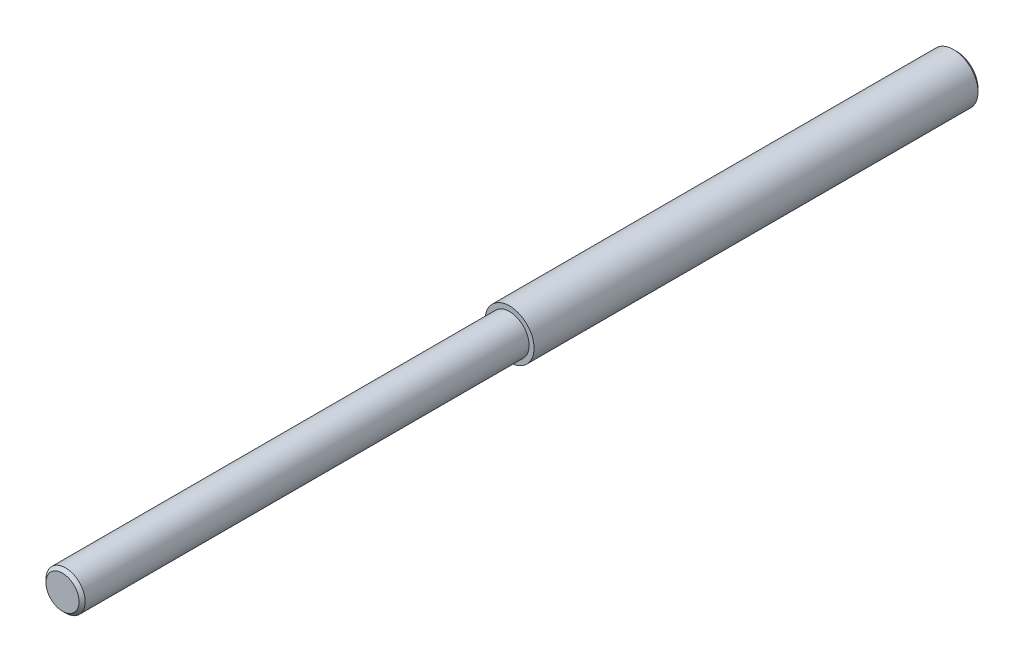
from build123d import *

# Parameters (mm, degrees)
SKETCH1_R           = 4
BOSS_EXTRUDE1_DEPTH = 73
SKETCH2_R           = 3.2
BOSS_EXTRUDE2_DEPTH = 73
CHAMFER1_SIZE       = 0.5


with BuildPart() as part:
    # Sketch1 → Boss-Extrude1 (new body)
    with BuildSketch(Plane.XY):
        Circle(SKETCH1_R)
    extrude(amount=BOSS_EXTRUDE1_DEPTH)

    # Sketch2 → Boss-Extrude2 (add)
    with BuildSketch(Plane.XY.offset(73)):
        Circle(SKETCH2_R)
    extrude(amount=BOSS_EXTRUDE2_DEPTH)

    # Chamfer1
    chamfer1_edges = [part.edges().sort_by_distance(p)[0] for p in [
        (-4, 0, 0),
        (-3.2, 0, 146),
    ]]
    chamfer(chamfer1_edges, length=CHAMFER1_SIZE)


solid = part.part
